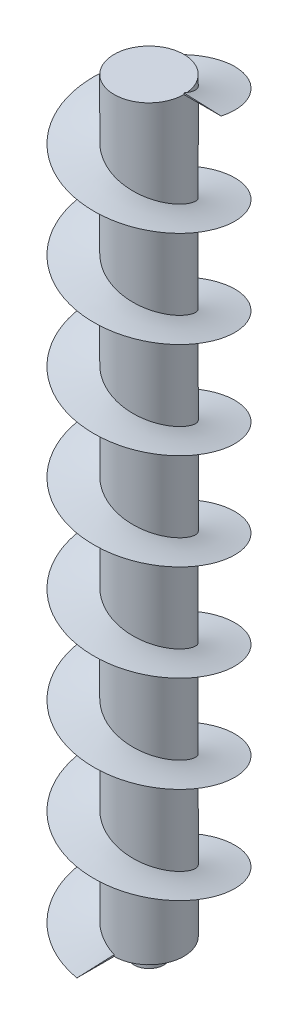
from build123d import *

# Parameters (mm, degrees)
SKETCH_1_R          = 7
EXTRUDE_1_DEPTH     = 150
SWEEP_2_PITCH       = 19.35483871
SWEEP_2_HEIGHT      = 150
SWEEP_2_RADIUS      = 7
SKETCH_8_R          = 3
EXTRUDE_2_DEPTH     = 5
CUT_EXTRUDE_START   = -1.5
SKETCH_9_R          = 3
CUT_EXTRUDE_1_DEPTH = 1.5


with BuildPart() as part:
    # 草圖1 → 填料-伸長1 (new body)
    with BuildSketch(Plane(origin=(0, 0, 0), x_dir=(1, 0, 0), z_dir=(0, 1, 0))):
        with Locations(Location((0, 0, 0), (0, 0, 270))):
            Circle(SKETCH_1_R)
    extrude(amount=EXTRUDE_1_DEPTH)

    # 掃出2: sweep along a helix
    with BuildLine() as sweep_2_path:
        Helix(SWEEP_2_PITCH, SWEEP_2_HEIGHT, SWEEP_2_RADIUS, center=(0, 0, 0), direction=(0, 1, 0), lefthand=True)
    # 草圖4 → 掃出2 (sweep)
    with BuildSketch(Plane(origin=(0, 0, 0), x_dir=(0, 0, -1), z_dir=(1, 0, 0))):
        Polygon((-7, 0.3), (-14.5, 0), (-7, 0), align=None)
    sweep(path=sweep_2_path.line, is_frenet=True)

    # 草圖8 → 填料-伸長2 (add)
    with BuildSketch(Plane.XZ):
        with Locations(Location((0, 0, 0), (0, 0, 90))):
            Circle(SKETCH_8_R)
    extrude(amount=EXTRUDE_2_DEPTH)

    # 草圖9 → 除料-伸長1 (cut)
    with BuildSketch(Plane.XZ.offset(5).offset(CUT_EXTRUDE_START)):
        with Locations(Location((0, 0, 0), (0, 0, 90))):
            Circle(SKETCH_9_R)
    extrude(amount=CUT_EXTRUDE_1_DEPTH, mode=Mode.SUBTRACT)


solid = part.part
